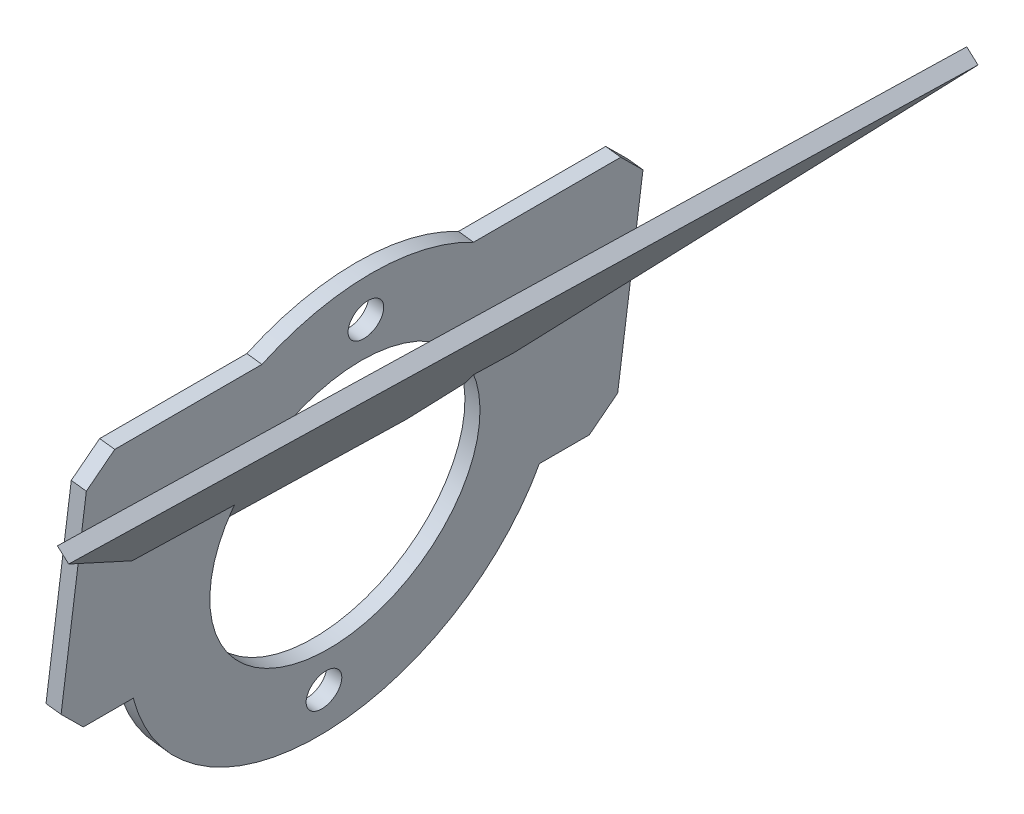
from build123d import *

# Parameters (mm, degrees)
BOSS_EXTRUDE1_START = -15.9
BOSS_EXTRUDE1_DEPTH = 3
SKETCH3_R           = 3.5
SKETCH3_R_2         = 26.5
BOSS_EXTRUDE2_DEPTH = 3


with BuildPart() as part:
    # Sketch2 → Boss-Extrude1 (new body)
    with BuildSketch(Plane(origin=(117.356768786, -100.303676541, 2.735224282), x_dir=(0.013083184034836956, -0.011957631507149957, -0.9998429103335432), z_dir=(0.7600578289260114, -0.6496139542146466, 0.017714603520517413)).offset(BOSS_EXTRUDE1_START)):
        Polygon((-30.278336534, 861.616572504), (-81.514394736, 916.616572504), (95.889916348, 916.616572504), (19.752599346, 861.616572504), align=None)
    extrude(amount=-BOSS_EXTRUDE1_DEPTH)


with BuildPart() as body_2:
    # Sketch3 → Boss-Extrude2 (new body)
    with BuildSketch(Plane(origin=(590.029393702, -72.446500026, 0), x_dir=(0, 0, -1), z_dir=(0.992546151641322, -0.12186934340514777, 0))):
        with BuildLine():
            Line((40.127920454, 625.394614031), (49.999999876, 625.394613247))
            Line((49.999999876, 625.394613247), (54.999999876, 630.394613247))
            Line((54.999999876, 630.394613247), (54.999999876, 671.394613247))
            Line((54.999999876, 671.394613247), (49.999999876, 676.394613247))
            Line((49.999999876, 676.394613247), (20.910523666, 676.394613247))
            ThreePointArc((20.910523666, 676.394613247), (0, 681.894613247), (-20.910523666, 676.394613247))
            Line((-20.910523666, 676.394613247), (-50, 676.394613247))
            Line((-50, 676.394613247), (-55, 671.394613247))
            Line((-55, 671.394613247), (-55, 630.394613247))
            Line((-55, 630.394613247), (-50, 625.394613247))
            Line((-50, 625.394613247), (-40.127920454, 625.394614031))
            ThreePointArc((-40.127920454, 625.394614031), (0, 596.894614031), (40.127920454, 625.394614031))
        make_face()
        with Locations(Location((0, 605.394615096, 0), (0, 0, 90))):
            Circle(SKETCH3_R, mode=Mode.SUBTRACT)
        with Locations(Location((0, 673.394612265, 0), (0, 0, 90))):
            Circle(SKETCH3_R, mode=Mode.SUBTRACT)
        with Locations(Location((0, 639.394613247, 0), (0, 0, 90))):
            Circle(SKETCH3_R_2, mode=Mode.SUBTRACT)
    extrude(amount=BOSS_EXTRUDE2_DEPTH)


solid = Compound([part.part, body_2.part])
